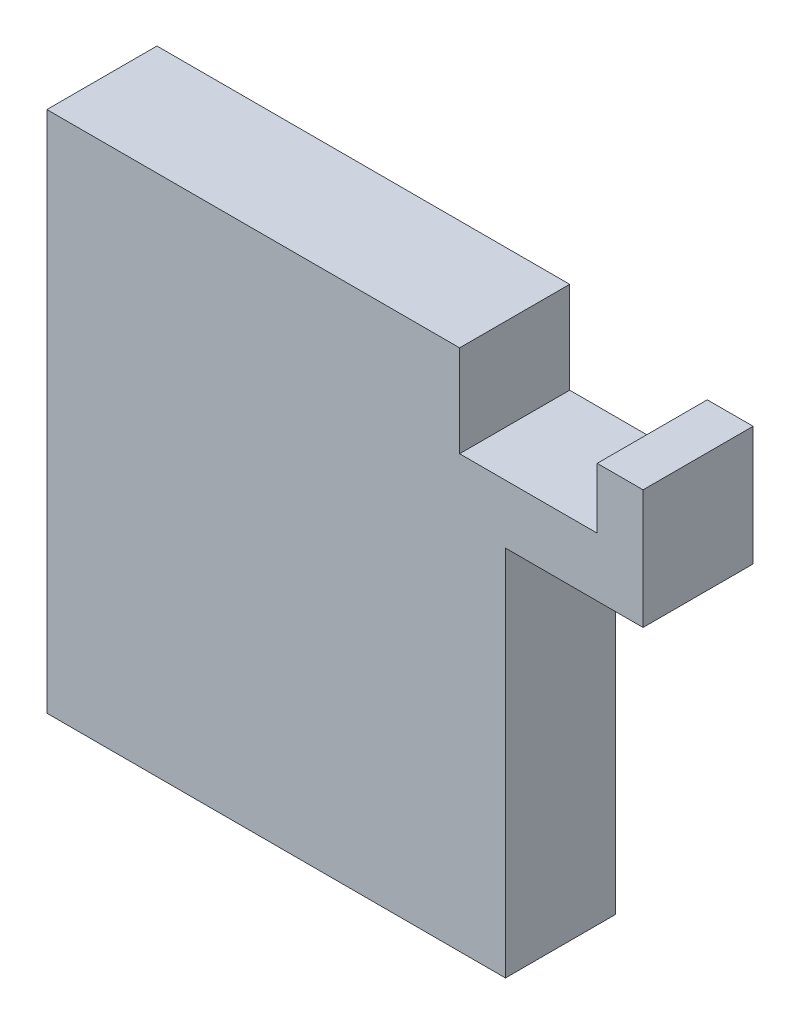
from build123d import *

# Parameters (mm, degrees)
EXTRUDE_1_DEPTH = 1.2


with BuildPart() as part:
    # 草图1 → 凸台-拉伸1 (new body)
    with BuildSketch(Plane.XY):
        Polygon((4.219252835, 10.5), (4.219252835, 4.8), (9.219252835, 4.8), (9.219252835, 8.859461555), (10.719252835, 8.859461555), (10.719252835, 10.159461555), (10.219252835, 10.159461555), (10.219252835, 9.5), (8.719252835, 9.5), (8.719252835, 10.5), align=None)
    extrude(amount=EXTRUDE_1_DEPTH)


solid = part.part
